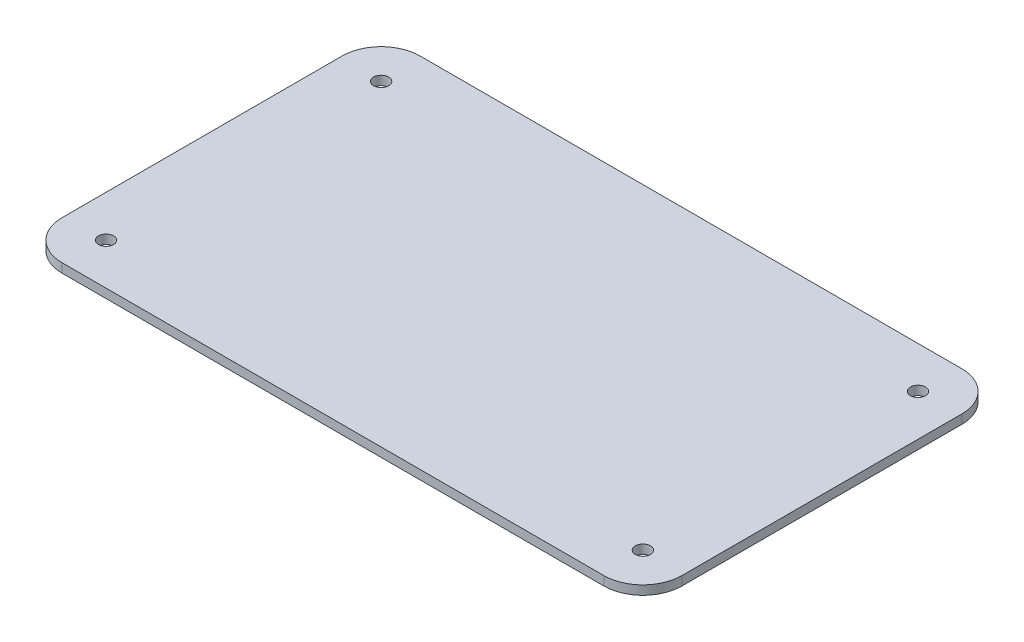
from build123d import *

# Parameters (mm, degrees)
SKETCH2_R           = 2.5
BOSS_EXTRUDE1_DEPTH = 3


with BuildPart() as part:
    # Sketch2 → Boss-Extrude1 (new body)
    with BuildSketch(Plane(origin=(0, 0, 0), x_dir=(1, 0, 0), z_dir=(0, 1, 0))):
        with BuildLine():
            Line((-89.75, -59.325), (89.75, -59.325))
            ThreePointArc((89.75, -59.325), (98.899961749, -55.534961749), (102.69, -46.385))
            Line((102.69, -46.385), (102.69, 46.385))
            ThreePointArc((102.69, 46.385), (98.899961749, 55.534961749), (89.75, 59.325))
            Line((89.75, 59.325), (-89.75, 59.325))
            ThreePointArc((-89.75, 59.325), (-98.899961749, 55.534961749), (-102.69, 46.385))
            Line((-102.69, 46.385), (-102.69, -46.385))
            ThreePointArc((-102.69, -46.385), (-98.899961749, -55.534961749), (-89.75, -59.325))
        make_face()
        with Locations(Location((-88.94, 45.575, 0), (0, 0, 270))):
            Circle(SKETCH2_R, mode=Mode.SUBTRACT)
        with Locations(Location((88.94, 45.575, 0), (0, 0, 90))):
            Circle(SKETCH2_R, mode=Mode.SUBTRACT)
        with Locations(Location((88.94, -45.575, 0), (0, 0, 270))):
            Circle(SKETCH2_R, mode=Mode.SUBTRACT)
        with Locations(Location((-88.94, -45.575, 0), (0, 0, 90))):
            Circle(SKETCH2_R, mode=Mode.SUBTRACT)
    extrude(amount=BOSS_EXTRUDE1_DEPTH)


solid = part.part
